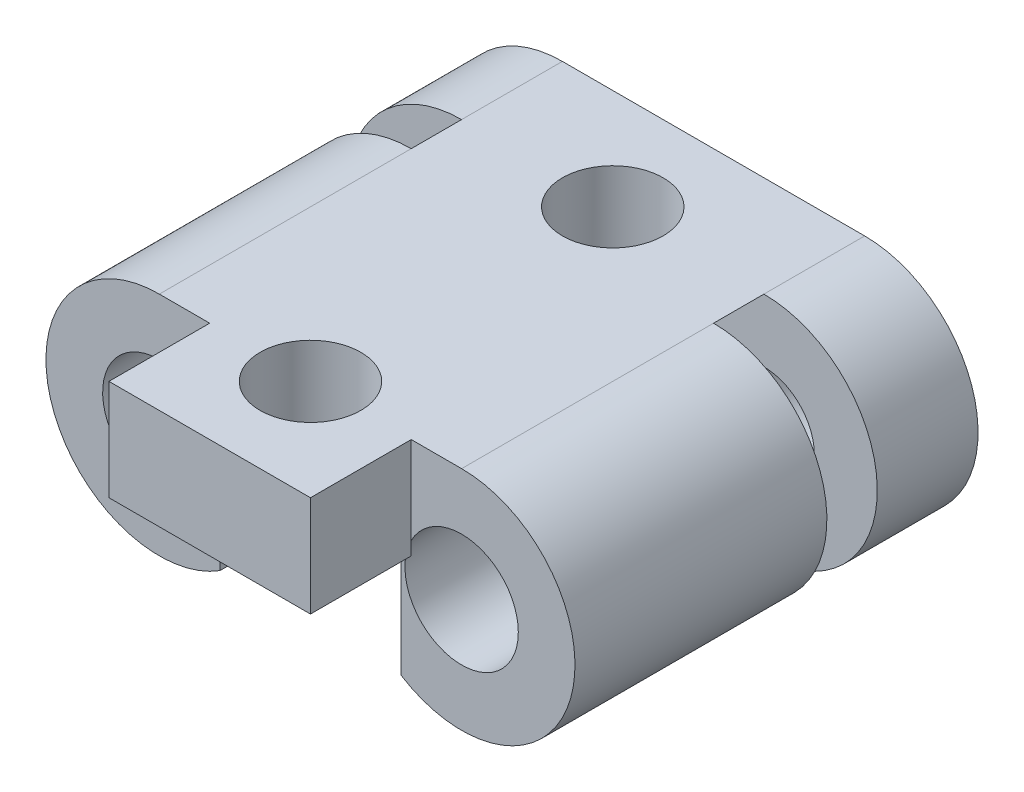
from build123d import *

# Parameters (mm, degrees)
SKETCH2_W           = 8
SKETCH2_H           = 20
SKETCH2_R           = 2
BOSS_EXTRUDE2_DEPTH = 4
SKETCH3_R           = 2
BOSS_EXTRUDE3_DEPTH = 16
SKETCH5_R           = 2.25
CUT_EXTRUDE1_DEPTH  = 10
CUT_EXTRUDE2_START  = -2
SKETCH6_R           = 4.5
CUT_EXTRUDE2_DEPTH  = 2
SKETCH7_R           = 3.6
CUT_EXTRUDE3_DEPTH  = 16.337861816
SKETCH8_R           = 2
CUT_EXTRUDE4_DEPTH  = 18.066048339


with BuildPart() as part:
    # Sketch2 → Boss-Extrude2 (new body)
    with BuildSketch(Plane(origin=(0, 0, 0), x_dir=(1, 0, 0), z_dir=(0, 1, 0))):
        Rectangle(SKETCH2_W, SKETCH2_H)
        with Locations(Location((0, 6, 0), (0, 0, 270))):
            Circle(SKETCH2_R, mode=Mode.SUBTRACT)
        with Locations(Location((0, -6, 0), (0, 0, 270))):
            Circle(SKETCH2_R, mode=Mode.SUBTRACT)
    extrude(amount=-BOSS_EXTRUDE2_DEPTH)

    # Sketch3 → Boss-Extrude3 (add)
    # profile 1 of 2: a face of its own
    with BuildSketch(Plane.XY.offset(-10)):
        with BuildLine():
            Line((6, 0), (4, 0))
            Line((4, 0), (4, -0.468871126))
            ThreePointArc((4, -0.468871126), (7.027112473, -8.88121444), (6, 0))
        make_face()
        with Locations((6, -4.5)):
            Circle(SKETCH3_R, mode=Mode.SUBTRACT)
    # profile 2 of 2: a face of its own
    with BuildSketch(Plane.XY.offset(-10)):
        with BuildLine():
            Line((-6, 0), (-4, 0))
            Line((-4, 0), (-4, -0.468871126))
            ThreePointArc((-4, -0.468871126), (-7.027112473, -8.88121444), (-6, 0))
        make_face()
        with Locations((-6, -4.5)):
            Circle(SKETCH3_R, mode=Mode.SUBTRACT)
    extrude(amount=BOSS_EXTRUDE3_DEPTH)

    # Sketch5 → Cut-Extrude1 (cut)
    with BuildSketch(Plane.XY.offset(6)):
        with Locations(Location((-6, -4.5, 0), (0, 0, 12.839588407))):
            Circle(SKETCH5_R)
        with Locations(Location((6, -4.5, 0), (0, 0, 152.733955549))):
            Circle(SKETCH5_R)
    extrude(amount=-CUT_EXTRUDE1_DEPTH, mode=Mode.SUBTRACT)

    # Sketch6 → Cut-Extrude2 (cut)
    with BuildSketch(Plane.XY.offset(-4).offset(CUT_EXTRUDE2_START)):
        with Locations((6, -4.5)):
            Circle(SKETCH6_R)
        with Locations((-6, -4.5)):
            Circle(SKETCH6_R)
    extrude(amount=CUT_EXTRUDE2_DEPTH, mode=Mode.SUBTRACT)

    # Sketch7 → Cut-Extrude3 (cut, through all)
    with BuildSketch(Plane.XZ.offset(4)):
        with Locations((0, 6)):
            Circle(SKETCH7_R)
        with Locations((0, -6)):
            Circle(SKETCH7_R)
    extrude(amount=CUT_EXTRUDE3_DEPTH, mode=Mode.SUBTRACT)

    # Sketch8 → Cut-Extrude4 (cut, through all)
    with BuildSketch(Plane(origin=(0, 0, 0), x_dir=(1, 0, 0), z_dir=(0, 1, 0))):
        with Locations(Location((0, 6, 0), (0, 0, 270))):
            Circle(SKETCH8_R)
        with Locations(Location((0, -6, 0), (0, 0, 270))):
            Circle(SKETCH8_R)
    extrude(amount=-CUT_EXTRUDE4_DEPTH, mode=Mode.SUBTRACT)


solid = part.part
